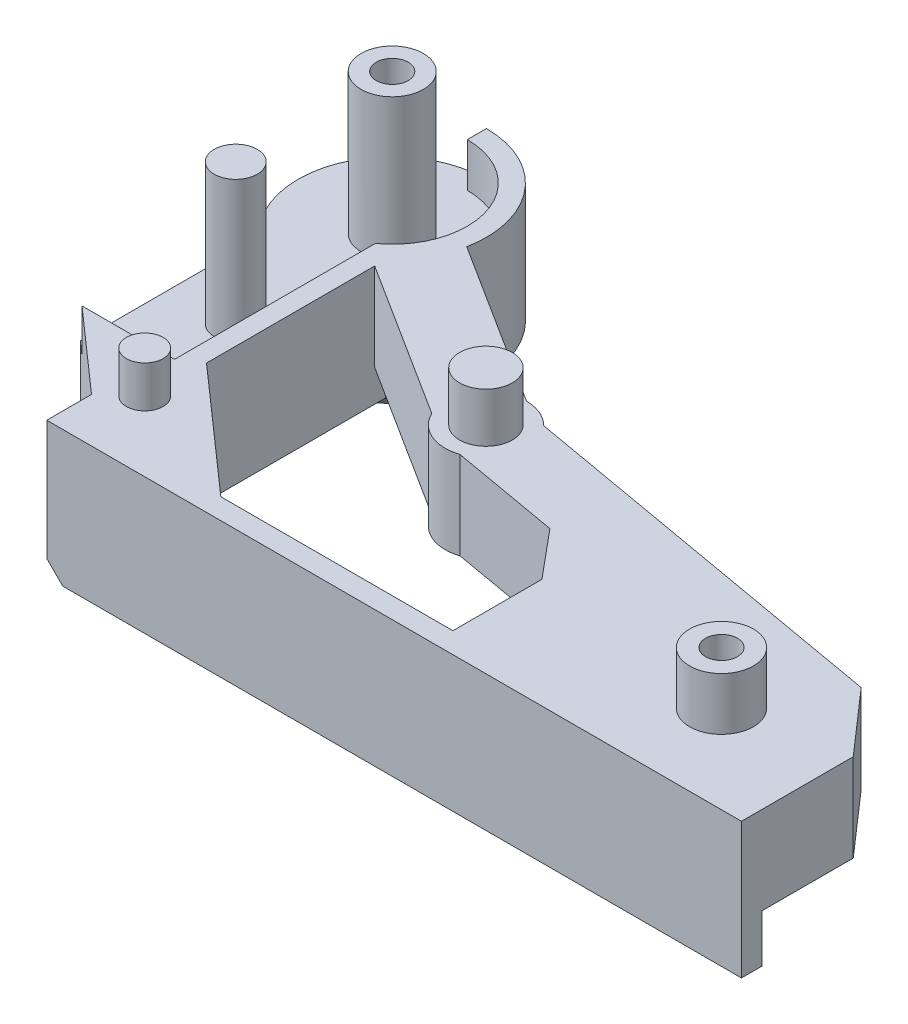
from build123d import *

# Parameters (mm, degrees)
BOSS_EXTRUDE1_DEPTH      = 5.5
SKETCH2_R                = 1.65
CUT_EXTRUDE1_DEPTH       = 5.5
BOSS_EXTRUDE2_DEPTH      = 3
CUT_EXTRUDE2_DEPTH       = 2.75
SKETCH5_R                = 1.95
SKETCH5_R_2              = 1.35
SKETCH5_R_3              = 1.15
SKETCH5_R_4              = 2
CUT_EXTRUDE3_DEPTH       = 4.3
SKETCH7_R                = 1.95
SKETCH7_R_2              = 1.35
CUT_EXTRUDE4_DEPTH       = 3
CHAMFER1_SIZE            = 1
CUT_EXTRUDE5_DEPTH       = 2.75
SKETCH9_R                = 1.95
BOSS_EXTRUDE3_DEPTH      = 13.35
CUT_EXTRUDE6_START       = -8.8
SKETCH10_R               = 1
CUT_EXTRUDE6_DEPTH       = 8.8
SKETCH11_R               = 1.35
BOSS_EXTRUDE4_DEPTH      = 13.35
SKETCH12_R               = 1.15
BOSS_EXTRUDE5_DEPTH      = 6.9
SKETCH13_R               = 2
BOSS_EXTRUDE6_DEPTH      = 7.6
CUT_EXTRUDE7_START       = -3.3
SKETCH14_R               = 1
CUT_EXTRUDE7_DEPTH       = 3.3
BOSS_EXTRUDE7_DEPTH      = 3.1
BOSS_EXTRUDE7_DEPTH_BACK = 1.2
SKETCH15_R               = 1.65
SKETCH16_R               = 1
CUT_EXTRUDE8_DEPTH       = 3.1


with BuildPart() as part:
    # Sketch1 → Boss-Extrude1 (new body)
    with BuildSketch(Plane(origin=(0, 0, 0), x_dir=(1, 0, 0), z_dir=(0, 1, 0))):
        with BuildLine():
            Line((-7.755996733, 16.049992949), (-18.008818061, 22.554712546))
            ThreePointArc((-18.008818061, 22.554712546), (-25.669699487, 29.278547542), (-27.75, 19.3))
            Line((-27.75, 19.3), (-27.75, 8.1))
            Line((-27.75, 8.1), (-21.75, 2.8))
            Line((-21.75, 2.8), (-21.75, 0))
            Line((-21.75, 0), (21.75, 0))
            Line((21.75, 0), (21.75, 7))
            Line((21.75, 7), (18.25, 11))
            Line((18.25, 11), (-5.907756778, 15.263133549))
            ThreePointArc((-5.907756778, 15.263133549), (-6.75113203, 15.846223088), (-7.755996733, 16.049992949))
        make_face()
        with BuildLine():
            Line((-19.85, 18.630440726), (-10.05956754, 12.419075498))
            ThreePointArc((-10.05956754, 12.419075498), (-8.75757921, 11.15750472), (-6.94630287, 11.079964685))
            Line((-6.94630287, 11.079964685), (-0.119008465, 9.875148026))
            Line((-0.119008465, 9.875148026), (2.380991535, 6.875148026))
            Line((2.380991535, 6.875148026), (2.380991535, 1.3))
            Line((2.380991535, 1.3), (-12.151886792, 1.3))
            Line((-12.151886792, 1.3), (-19.85, 8.1))
            Line((-19.85, 8.1), (-19.85, 18.630440726))
        make_face(mode=Mode.SUBTRACT)
    extrude(amount=BOSS_EXTRUDE1_DEPTH)

    # Sketch2 → Cut-Extrude1 (cut)
    with BuildSketch(Plane(origin=(0, 5.5, 0), x_dir=(1, 0, 0), z_dir=(0, 1, 0))):
        with Locations(Location((-7.75, 13.5, 0), (0, 0, 270))):
            Circle(SKETCH2_R)
    extrude(amount=-CUT_EXTRUDE1_DEPTH, mode=Mode.SUBTRACT)

    # Sketch3 → Boss-Extrude2 (add)
    with BuildSketch(Plane(origin=(0, 5.5, 0), x_dir=(1, 0, 0), z_dir=(0, 1, 0))):
        with BuildLine():
            ThreePointArc((-27.75, 19.3), (-23.8, 17.782636193), (-19.85, 19.3))
            ThreePointArc((-19.85, 19.3), (-18.664735174, 20.777631), (-18.008818061, 22.554712546))
            ThreePointArc((-18.008818061, 22.554712546), (-17.927267525, 23.116055854), (-17.9, 23.682636193))
            ThreePointArc((-17.9, 23.682636193), (-26.198436991, 29.073137097), (-27.75, 19.3))
        make_face()
        with BuildLine():
            Line((-12.151886792, 1.3), (-19.85, 8.1))
            Line((-19.85, 8.1), (-19.85, 18.630440726))
            Line((-19.85, 18.630440726), (-19.85, 19.3))
            ThreePointArc((-19.85, 19.3), (-23.8, 17.782636193), (-27.75, 19.3))
            Line((-27.75, 19.3), (-27.75, 8.1))
            Line((-27.75, 8.1), (-21.75, 2.8))
            Line((-21.75, 2.8), (-21.75, 0))
            Line((-21.75, 0), (21.75, 0))
            Line((21.75, 0), (21.75, 1.3))
            Line((21.75, 1.3), (2.380991535, 1.3))
            Line((2.380991535, 1.3), (-12.151886792, 1.3))
        make_face()
    extrude(amount=BOSS_EXTRUDE2_DEPTH)

    # Sketch4 → Cut-Extrude2 (cut)
    with BuildSketch(Plane.XZ):
        with BuildLine():
            ThreePointArc((-27.75, -19.3), (-29.307610804, -25.798344876), (-23.8, -29.582636193))
            Line((-23.8, -29.582636193), (-23.8, -7.3))
            Line((-23.8, -7.3), (-26.844339623, -7.3))
            Line((-26.844339623, -7.3), (-27.75, -8.1))
            Line((-27.75, -8.1), (-27.75, -19.3))
        make_face()
    extrude(amount=-CUT_EXTRUDE2_DEPTH, mode=Mode.SUBTRACT)

    # Sketch5 → Cut-Extrude3 (cut)
    with BuildSketch(Plane.XZ):
        with Locations(Location((-23.8, -23.682636193, 0), (0, 0, 90))):
            Circle(SKETCH5_R)
        with Locations(Location((-23.8, -13.882636193, 0), (0, 0, 90))):
            Circle(SKETCH5_R_2)
        with Locations(Location((-20, -4.382636193, 0), (0, 0, 270))):
            Circle(SKETCH5_R_3)
        with Locations(Location((15.000589162, -5.5, 0), (0, 0, 270))):
            Circle(SKETCH5_R_4)
    extrude(amount=-CUT_EXTRUDE3_DEPTH, mode=Mode.SUBTRACT)

    # Sketch7 → Cut-Extrude4 (cut)
    with BuildSketch(Plane.XZ.offset(-4.3)):
        with Locations(Location((-23.8, -23.682636193, 0), (0, 0, 90))):
            Circle(SKETCH7_R)
        with Locations(Location((-23.8, -13.882636193, 0), (0, 0, 90))):
            Circle(SKETCH7_R_2)
    extrude(amount=-CUT_EXTRUDE4_DEPTH, mode=Mode.SUBTRACT)

    # Chamfer1
    chamfer1_edges = [part.edges().sort_by_distance(p)[0] for p in [
        (-23.8, 8.5, -29.582636193),
        (-27.75, 8.5, -13.7),
        (-24.75, 8.5, -5.45),
        (-21.75, 8.5, -1.4),
        (-19.85, 8.5, -13.7),
    ]]
    chamfer(chamfer1_edges, length=CHAMFER1_SIZE)

    # Sketch8 → Cut-Extrude5 (cut)
    with BuildSketch(Plane.XZ):
        with BuildLine():
            Line((-21.05, -7.3), (-23.8, -7.3))
            Line((-23.8, -7.3), (-23.8, -12.532636193))
            ThreePointArc((-23.8, -12.532636193), (-22.45, -13.882636193), (-23.8, -15.232636193))
            Line((-23.8, -15.232636193), (-23.8, -18.982636193))
            ThreePointArc((-23.8, -18.982636193), (-22.355013861, -19.210274953), (-21.05, -19.871140424))
            Line((-21.05, -19.871140424), (-21.05, -7.3))
        make_face()
        with BuildLine():
            ThreePointArc((-19.1, -23.682636193), (-19.615803542, -21.54195873), (-21.05, -19.871140424))
            ThreePointArc((-21.05, -19.871140424), (-22.355013861, -19.210274953), (-23.8, -18.982636193))
            Line((-23.8, -18.982636193), (-23.8, -21.732636193))
            ThreePointArc((-23.8, -21.732636193), (-21.85, -23.682636193), (-23.8, -25.632636193))
            Line((-23.8, -25.632636193), (-23.8, -28.382636193))
            ThreePointArc((-23.8, -28.382636193), (-20.476598128, -27.006038065), (-19.1, -23.682636193))
        make_face()
        with BuildLine():
            Line((-23.8, -21.732636193), (-23.8, -18.982636193))
            ThreePointArc((-23.8, -18.982636193), (-28.5, -23.682636193), (-23.8, -28.382636193))
            Line((-23.8, -28.382636193), (-23.8, -25.632636193))
            ThreePointArc((-23.8, -25.632636193), (-21.85, -23.682636193), (-23.8, -21.732636193))
        make_face()
    extrude(amount=-CUT_EXTRUDE5_DEPTH, mode=Mode.SUBTRACT)


with BuildPart() as body_2:
    # Mirror1: mirrored copy
    add(part.part.mirror(Plane.ZX))

    # Sketch9 → Boss-Extrude3 (add)
    with BuildSketch(Plane(origin=(0, -7.3, 0), x_dir=(1, 0, 0), z_dir=(0, 1, 0))):
        with Locations(Location((-23.8, 23.682636193, 0), (0, 0, 90))):
            Circle(SKETCH9_R)
    extrude(amount=BOSS_EXTRUDE3_DEPTH)

    # Sketch10 → Cut-Extrude6 (cut)
    with BuildSketch(Plane(origin=(0, 6.05, 0), x_dir=(1, 0, 0), z_dir=(0, 1, 0)).offset(CUT_EXTRUDE6_START)):
        with Locations(Location((-23.8, 23.682636193, 0), (0, 0, 270))):
            Circle(SKETCH10_R)
    extrude(amount=CUT_EXTRUDE6_DEPTH, mode=Mode.SUBTRACT)

    # Sketch11 → Boss-Extrude4 (add)
    with BuildSketch(Plane(origin=(0, -7.3, 0), x_dir=(1, 0, 0), z_dir=(0, 1, 0))):
        with Locations(Location((-23.8, 13.882636193, 0), (0, 0, 90))):
            Circle(SKETCH11_R)
    extrude(amount=BOSS_EXTRUDE4_DEPTH)

    # Sketch12 → Boss-Extrude5 (add)
    with BuildSketch(Plane(origin=(0, -4.3, 0), x_dir=(1, 0, 0), z_dir=(0, 1, 0))):
        with Locations(Location((-20, 4.382636193, 0), (0, 0, 90))):
            Circle(SKETCH12_R)
    extrude(amount=BOSS_EXTRUDE5_DEPTH)

    # Sketch13 → Boss-Extrude6 (add)
    with BuildSketch(Plane(origin=(0, -4.3, 0), x_dir=(1, 0, 0), z_dir=(0, 1, 0))):
        with Locations(Location((15.000589162, 5.5, 0), (0, 0, 90))):
            Circle(SKETCH13_R)
    extrude(amount=BOSS_EXTRUDE6_DEPTH)

    # Sketch14 → Cut-Extrude7 (cut)
    with BuildSketch(Plane(origin=(0, 3.3, 0), x_dir=(1, 0, 0), z_dir=(0, 1, 0)).offset(CUT_EXTRUDE7_START)):
        with Locations(Location((15.000589162, 5.5, 0), (0, 0, 270))):
            Circle(SKETCH14_R)
    extrude(amount=CUT_EXTRUDE7_DEPTH, mode=Mode.SUBTRACT)

    # Sketch15 → Boss-Extrude7 (add, two sides: drawn at the far end of the back side and taken through both)
    with BuildSketch(Plane(origin=(0, 0, 0), x_dir=(1, 0, 0), z_dir=(0, 1, 0)).offset(-BOSS_EXTRUDE7_DEPTH_BACK)):
        with Locations(Location((-7.75, 13.5, 0), (0, 0, 270))):
            Circle(SKETCH15_R)
    extrude(amount=BOSS_EXTRUDE7_DEPTH + BOSS_EXTRUDE7_DEPTH_BACK)

    # Sketch16 → Cut-Extrude8 (cut)
    with BuildSketch(Plane.XZ.offset(1.2)):
        with Locations(Location((-7.75, -13.5, 0), (0, 0, 270))):
            Circle(SKETCH16_R)
    extrude(amount=-CUT_EXTRUDE8_DEPTH, mode=Mode.SUBTRACT)


solid = body_2.part
